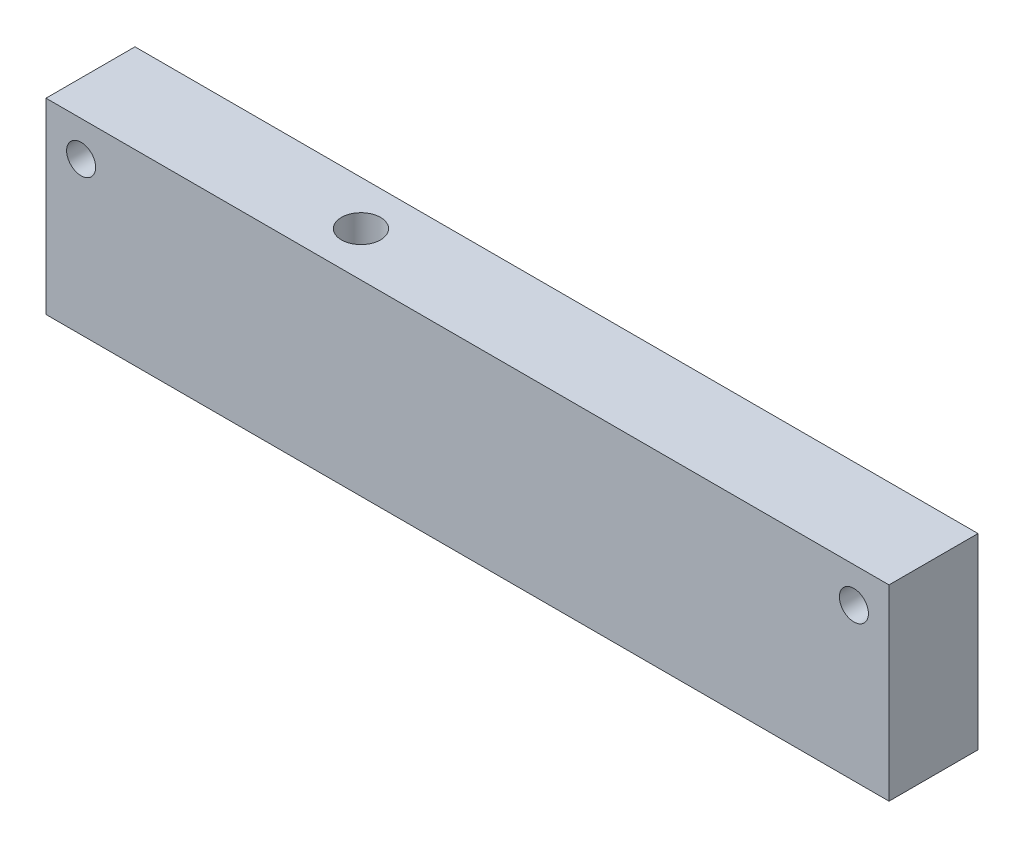
from build123d import *

# Parameters (mm, degrees)
SKETCH1_W           = 180
SKETCH1_H           = 19
SKETCH1_R           = 3.1
SKETCH1_R_2         = 4.175
BOSS_EXTRUDE1_DEPTH = 20
SKETCH2_W           = 180
SKETCH2_H           = 19
SKETCH2_R           = 4.175
BOSS_EXTRUDE3_DEPTH = 20
SKETCH3_R           = 3.1
CUT_EXTRUDE1_DEPTH  = 20
BOSS_EXTRUDE4_START = -9.8
SKETCH4_R           = 3.1
SKETCH4_W           = 92
SKETCH4_H           = 25
SKETCH4_W_2         = 28
BOSS_EXTRUDE4_DEPTH = 9.8


with BuildPart() as part:
    # Sketch1 → Boss-Extrude1 (new body)
    with BuildSketch(Plane(origin=(0, 0, 0), x_dir=(1, 0, 0), z_dir=(0, 1, 0))):
        Rectangle(SKETCH1_W, SKETCH1_H)
        with Locations(Location((-82.5, 0, 0), (0, 0, 270))):
            Circle(SKETCH1_R, mode=Mode.SUBTRACT)
        with Locations(Location((82.5, 0, 0), (0, 0, 270))):
            Circle(SKETCH1_R, mode=Mode.SUBTRACT)
        with Locations(Location((-32.25, 0, 0), (0, 0, 270))):
            Circle(SKETCH1_R_2, mode=Mode.SUBTRACT)
    extrude(amount=BOSS_EXTRUDE1_DEPTH)

    # Sketch2 → Boss-Extrude3 (add)
    with BuildSketch(Plane(origin=(0, 20, 0), x_dir=(1, 0, 0), z_dir=(0, 1, 0))):
        Rectangle(SKETCH2_W, SKETCH2_H)
        with Locations(Location((-32.25, 0, 0), (0, 0, 270))):
            Circle(SKETCH2_R, mode=Mode.SUBTRACT)
    extrude(amount=BOSS_EXTRUDE3_DEPTH)

    # Sketch3 → Cut-Extrude1 (cut)
    with BuildSketch(Plane.XY.offset(9.5)):
        with Locations((-82.5, 32.5)):
            Circle(SKETCH3_R)
        with Locations((82.5, 32.5)):
            Circle(SKETCH3_R)
    extrude(amount=-CUT_EXTRUDE1_DEPTH, mode=Mode.SUBTRACT)

    # Sketch4 → Boss-Extrude4 (add)
    with BuildSketch(Plane(origin=(0, 0, -9.5), x_dir=(-1, 0, 0), z_dir=(0, 0, -1)).offset(BOSS_EXTRUDE4_START)):
        with Locations(Location((-82.5, 32.5, 0), (0, 0, 180))):
            Circle(SKETCH4_R)
        with Locations(Location((82.5, 32.5, 0), (0, 0, 180))):
            Circle(SKETCH4_R)
        with Locations((-26.5, 20)):
            Rectangle(SKETCH4_W, SKETCH4_H)
        with Locations((58.5, 20)):
            Rectangle(SKETCH4_W_2, SKETCH4_H)
    extrude(amount=BOSS_EXTRUDE4_DEPTH)


solid = part.part
